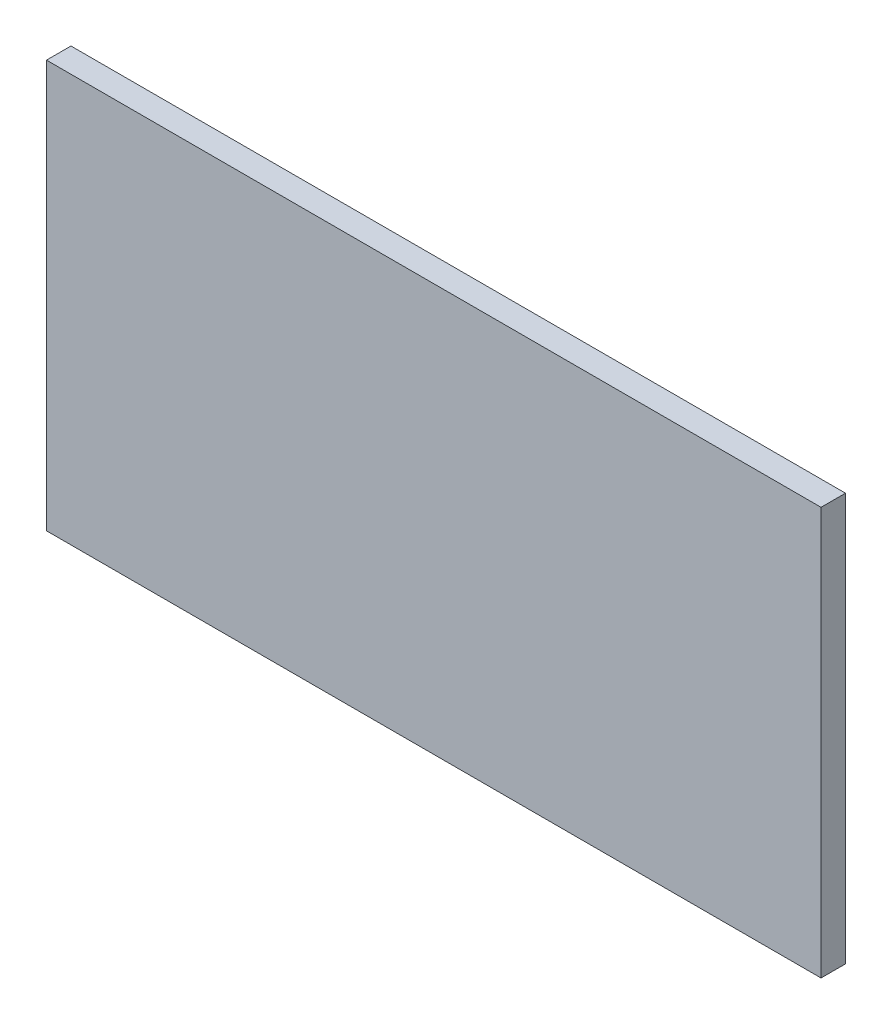
from build123d import *

# Parameters (mm, degrees)
SKETCH_1_W      = 380
SKETCH_1_H      = 200
EXTRUDE_1_DEPTH = 12


with BuildPart() as part:
    # 草图1 → 凸台-拉伸1 (new body)
    with BuildSketch(Plane.XY):
        with Locations((190, 100)):
            Rectangle(SKETCH_1_W, SKETCH_1_H)
    extrude(amount=EXTRUDE_1_DEPTH)


solid = part.part
